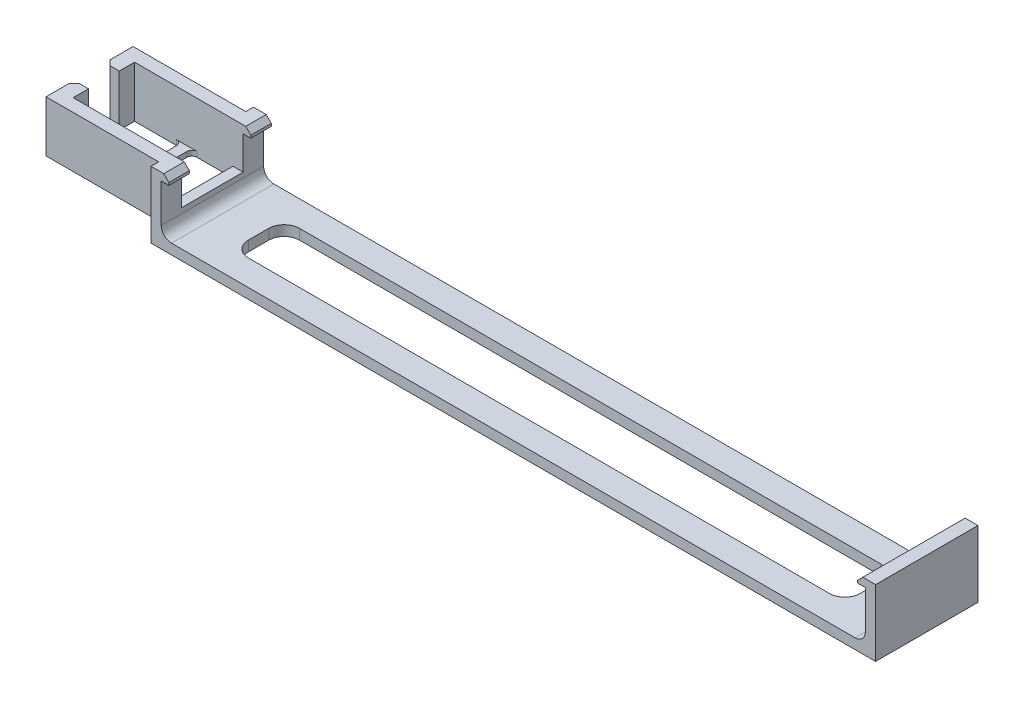
from build123d import *

# Parameters (mm, degrees)
SKETCH1_W               = 141.5
SKETCH1_H               = 20
BOSS_EXTRUDE1_DEPTH     = 2
SKETCH2_W               = 2
SKETCH2_H               = 20
BOSS_EXTRUDE2_DEPTH     = 11
SKETCH3_W               = 20
SKETCH3_H               = 1.5
BOSS_EXTRUDE3_DEPTH     = 1.5
CHAMFER1_SIZE           = 1
SKETCH4_W               = 20
SKETCH4_H               = 1.5
BOSS_EXTRUDE4_DEPTH     = 1.5
CHAMFER2_SIZE           = 1
CUT_EXTRUDE1_DEPTH      = 1.5
CUT_EXTRUDE1_DEPTH_BACK = 11.5
SKETCH5_W               = 12
SKETCH5_H               = 14.324896111
SKETCH6_W               = 2.5
SKETCH6_H               = 10
BOSS_EXTRUDE5_DEPTH     = 22
SKETCH7_W               = 2.8
SKETCH7_H               = 10
BOSS_EXTRUDE6_DEPTH     = 3
SKETCH8_W               = 2.8
SKETCH8_H               = 10
BOSS_EXTRUDE7_DEPTH     = 3
CHAMFER3_SIZE           = 1
SKETCH9_W               = 2
SKETCH9_H               = 17
BOSS_EXTRUDE8_DEPTH     = 1
FILLET1_R               = 1
FILLET2_R               = 2
SKETCH11_W              = 119.5
SKETCH11_H              = 10
CUT_EXTRUDE2_DEPTH      = 10
FILLET3_R               = 3


with BuildPart() as part:
    # Sketch1 → Boss-Extrude1 (new body)
    with BuildSketch(Plane(origin=(0, 0, 0), x_dir=(1, 0, 0), z_dir=(0, 1, 0))):
        Rectangle(SKETCH1_W, SKETCH1_H)
    extrude(amount=BOSS_EXTRUDE1_DEPTH)

    # Sketch2 → Boss-Extrude2 (add)
    with BuildSketch(Plane(origin=(0, 2, 0), x_dir=(1, 0, 0), z_dir=(0, 1, 0))):
        with Locations((69.75, 0)):
            Rectangle(SKETCH2_W, SKETCH2_H)
        with Locations((-69.75, 0)):
            Rectangle(SKETCH2_W, SKETCH2_H)
    extrude(amount=BOSS_EXTRUDE2_DEPTH)

    # Sketch3 → Boss-Extrude3 (add)
    with BuildSketch(Plane.ZY.offset(-68.75)):
        with Locations((0, 12.25)):
            Rectangle(SKETCH3_W, SKETCH3_H)
    extrude(amount=BOSS_EXTRUDE3_DEPTH)

    # Chamfer1
    chamfer1_edges = [part.edges().sort_by_distance(p)[0] for p in [
        (67.25, 13, 0),
    ]]
    chamfer(chamfer1_edges, length=CHAMFER1_SIZE)

    # Sketch4 → Boss-Extrude4 (add)
    with BuildSketch(Plane(origin=(-68.75, 0, 0), x_dir=(0, 0, -1), z_dir=(1, 0, 0))):
        with Locations((0, 12.25)):
            Rectangle(SKETCH4_W, SKETCH4_H)
    extrude(amount=BOSS_EXTRUDE4_DEPTH)

    # Chamfer2
    chamfer2_edges = [part.edges().sort_by_distance(p)[0] for p in [
        (-67.25, 13, 0),
    ]]
    chamfer(chamfer2_edges, length=CHAMFER2_SIZE)

    # Sketch5 → Cut-Extrude1 (cut, two sides: drawn at the far end of the back side and taken through both)
    with BuildSketch(Plane(origin=(-68.75, 0, 0), x_dir=(0, 0, -1), z_dir=(1, 0, 0)).offset(-CUT_EXTRUDE1_DEPTH_BACK)):
        with Locations((0, 12.162448056)):
            Rectangle(SKETCH5_W, SKETCH5_H)
    extrude(amount=CUT_EXTRUDE1_DEPTH + CUT_EXTRUDE1_DEPTH_BACK, mode=Mode.SUBTRACT)

    # Sketch6 → Boss-Extrude5 (add)
    with BuildSketch(Plane.ZY.offset(70.75)):
        with Locations((-7.25, 8)):
            Rectangle(SKETCH6_W, SKETCH6_H)
        with Locations((7.25, 8)):
            Rectangle(SKETCH6_W, SKETCH6_H)
    extrude(amount=BOSS_EXTRUDE5_DEPTH)

    # Sketch7 → Boss-Extrude6 (add)
    with BuildSketch(Plane(origin=(0, 0, 6), x_dir=(-1, 0, 0), z_dir=(0, 0, -1))):
        with Locations((91.35, 8)):
            Rectangle(SKETCH7_W, SKETCH7_H)
    extrude(amount=BOSS_EXTRUDE6_DEPTH)

    # Sketch8 → Boss-Extrude7 (add)
    with BuildSketch(Plane.XY.offset(-6)):
        with Locations((-91.35, 8)):
            Rectangle(SKETCH8_W, SKETCH8_H)
    extrude(amount=BOSS_EXTRUDE7_DEPTH)

    # Chamfer3
    chamfer3_edges = [part.edges().sort_by_distance(p)[0] for p in [
        (-92.75, 8, 3),
        (-92.75, 8, -3),
    ]]
    chamfer(chamfer3_edges, length=CHAMFER3_SIZE)

    # Sketch9 → Boss-Extrude8 (add)
    with BuildSketch(Plane.XZ.offset(-3)):
        with Locations((-79.75, 0)):
            Rectangle(SKETCH9_W, SKETCH9_H)
    extrude(amount=-BOSS_EXTRUDE8_DEPTH)

    # Fillet1
    fillet1_edges = [part.edges().sort_by_distance(p)[0] for p in [
        (-80.75, 3.5, -6),
        (-80.75, 3.5, 6),
        (-78.75, 3.5, -6),
        (-78.75, 3.5, 6),
    ]]
    fillet(fillet1_edges, radius=FILLET1_R)

    # Fillet2
    fillet2_edges = [part.edges().sort_by_distance(p)[0] for p in [
        (68.75, 2, 0),
        (-68.75, 2, 0),
    ]]
    fillet(fillet2_edges, radius=FILLET2_R)

    # Sketch11 → Cut-Extrude2 (cut)
    with BuildSketch(Plane(origin=(0, 2, 0), x_dir=(1, 0, 0), z_dir=(0, 1, 0))):
        Rectangle(SKETCH11_W, SKETCH11_H)
    extrude(amount=-CUT_EXTRUDE2_DEPTH, mode=Mode.SUBTRACT)

    # Fillet3
    fillet3_edges = [part.edges().sort_by_distance(p)[0] for p in [
        (-59.75, 1, 5),
        (-59.75, 1, -5),
        (59.75, 1, -5),
        (59.75, 1, 5),
    ]]
    fillet(fillet3_edges, radius=FILLET3_R)


solid = part.part
